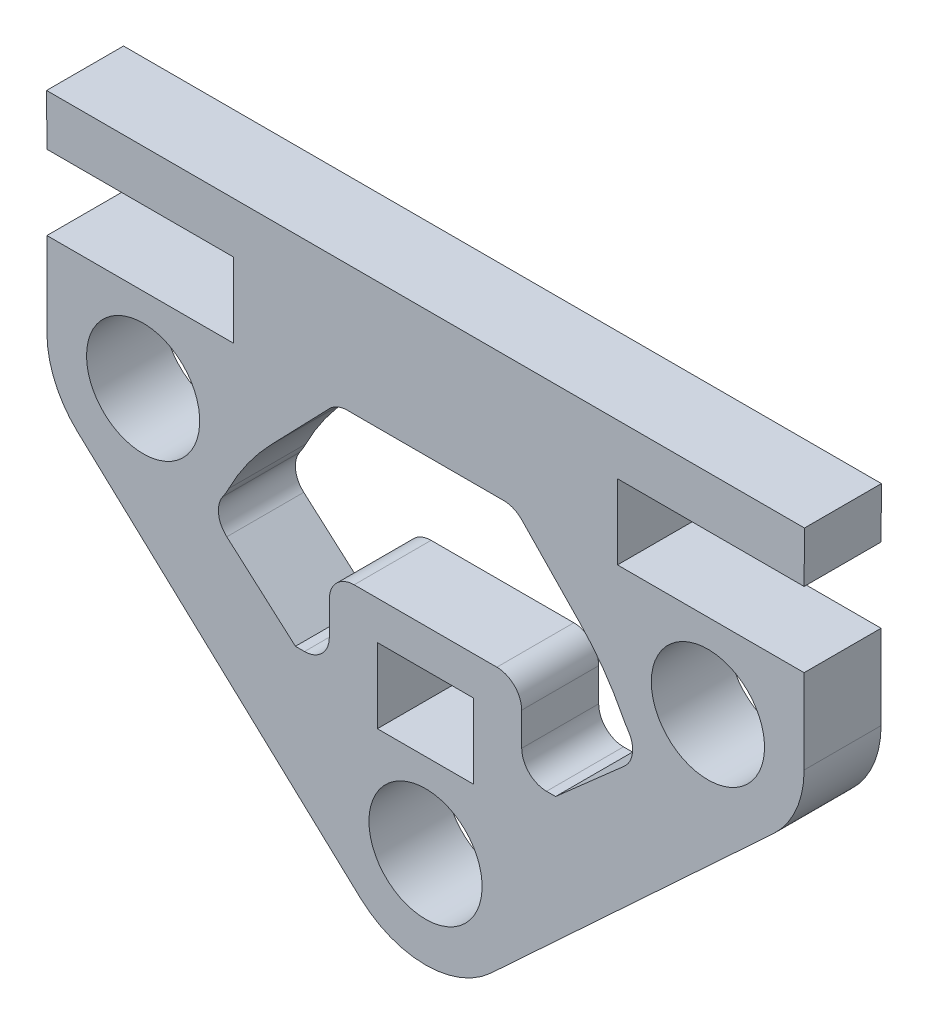
from build123d import *

# Parameters (mm, degrees)
SKETCH1_R      = 2.2795
SKETCH1_W      = 3.88
SKETCH1_H      = 3.007
EXTRUDE1_DEPTH = 3.1


with BuildPart() as part:
    # Sketch1 → Extrude1 (new body)
    with BuildSketch(Plane.XY):
        with BuildLine():
            Line((-41.027382287, 34.508489293), (-10.498924525, 34.508489293))
            Line((-10.498924525, 34.508489293), (-10.513157114, 32.461989293))
            Line((-10.513157114, 32.461989293), (-18.030657114, 32.461989293))
            Line((-18.030657114, 32.461989293), (-18.030657114, 29.454989293))
            Line((-18.030657114, 29.454989293), (-10.513157114, 29.454989293))
            Line((-10.513157114, 29.454989293), (-10.513157114, 26.058489293))
            ThreePointArc((-10.513157114, 26.058489293), (-10.83664158, 24.508533678), (-11.7530861, 23.217358224))
            Line((-11.7530861, 23.217358224), (-23.1280861, 12.667358224))
            ThreePointArc((-23.1280861, 12.667358224), (-25.763157114, 11.633489293), (-28.398228128, 12.667358224))
            Line((-28.398228128, 12.667358224), (-39.773228128, 23.217358224))
            ThreePointArc((-39.773228128, 23.217358224), (-40.689672648, 24.508533678), (-41.013157114, 26.058489293))
            Line((-41.013157114, 26.058489293), (-41.013157114, 29.454989293))
            Line((-41.013157114, 29.454989293), (-33.495657114, 29.454989293))
            Line((-33.495657114, 29.454989293), (-33.495657114, 32.461989293))
            Line((-33.495657114, 32.461989293), (-41.013157114, 32.461989293))
            Line((-41.013157114, 32.461989293), (-41.027382287, 34.508489293))
        make_face()
        with Locations(Location((-14.388157114, 26.058489293, 0), (0, 0, 180))):
            Circle(SKETCH1_R, mode=Mode.SUBTRACT)
        with Locations(Location((-37.138157114, 26.058489293, 0), (0, 0, 180))):
            Circle(SKETCH1_R, mode=Mode.SUBTRACT)
        with Locations(Location((-25.763157114, 15.508489293, 0), (0, 0, 180))):
            Circle(SKETCH1_R, mode=Mode.SUBTRACT)
        with BuildLine():
            Line((-33.76750302, 22.568552775), (-31.002944054, 20.130132194))
            Line((-31.002944054, 20.130132194), (-30.638157114, 20.130132194))
            ThreePointArc((-30.638157114, 20.130132194), (-29.931050333, 20.423025412), (-29.638157114, 21.130132194))
            Line((-29.638157114, 21.130132194), (-29.638157114, 22.458489293))
            ThreePointArc((-29.638157114, 22.458489293), (-29.345263895, 23.165596075), (-28.638157114, 23.458489293))
            Line((-28.638157114, 23.458489293), (-22.889213944, 23.458489293))
            ThreePointArc((-22.889213944, 23.458489293), (-22.182388419, 23.165877219), (-21.889214261, 22.459284647))
            Line((-21.889214261, 22.459284647), (-21.888157114, 21.130132194))
            ThreePointArc((-21.888157114, 21.130132194), (-21.595263895, 20.423025412), (-20.888157114, 20.130132194))
            Line((-20.888157114, 20.130132194), (-20.523370174, 20.130132194))
            Line((-20.523370174, 20.130132194), (-17.758811208, 22.568552775))
            ThreePointArc((-17.758811208, 22.568552775), (-17.428169762, 23.19327051), (-17.593190704, 23.880558008))
            ThreePointArc((-17.593190704, 23.880558008), (-17.720651816, 24.081090988), (-17.835582513, 24.289059126))
            ThreePointArc((-17.835582513, 24.289059126), (-18.600140603, 25.542598068), (-19.540017718, 26.670667198))
            Line((-19.540017718, 26.670667198), (-21.890008982, 29.103277241))
            ThreePointArc((-21.890008982, 29.103277241), (-22.218575416, 29.329029338), (-22.609223629, 29.408489293))
            Line((-22.609223629, 29.408489293), (-28.917090599, 29.408489293))
            ThreePointArc((-28.917090599, 29.408489293), (-29.307738812, 29.329029338), (-29.636305246, 29.103277241))
            Line((-29.636305246, 29.103277241), (-31.98629651, 26.670667198))
            ThreePointArc((-31.98629651, 26.670667198), (-32.926173625, 25.542598068), (-33.690731715, 24.289059126))
            ThreePointArc((-33.690731715, 24.289059126), (-33.805662411, 24.081090988), (-33.933123524, 23.880558008))
            ThreePointArc((-33.933123524, 23.880558008), (-34.098144466, 23.19327051), (-33.76750302, 22.568552775))
        make_face(mode=Mode.SUBTRACT)
        with Locations((-25.763157114, 20.408489293)):
            Rectangle(SKETCH1_W, SKETCH1_H, mode=Mode.SUBTRACT)
    extrude(amount=EXTRUDE1_DEPTH)


solid = part.part
